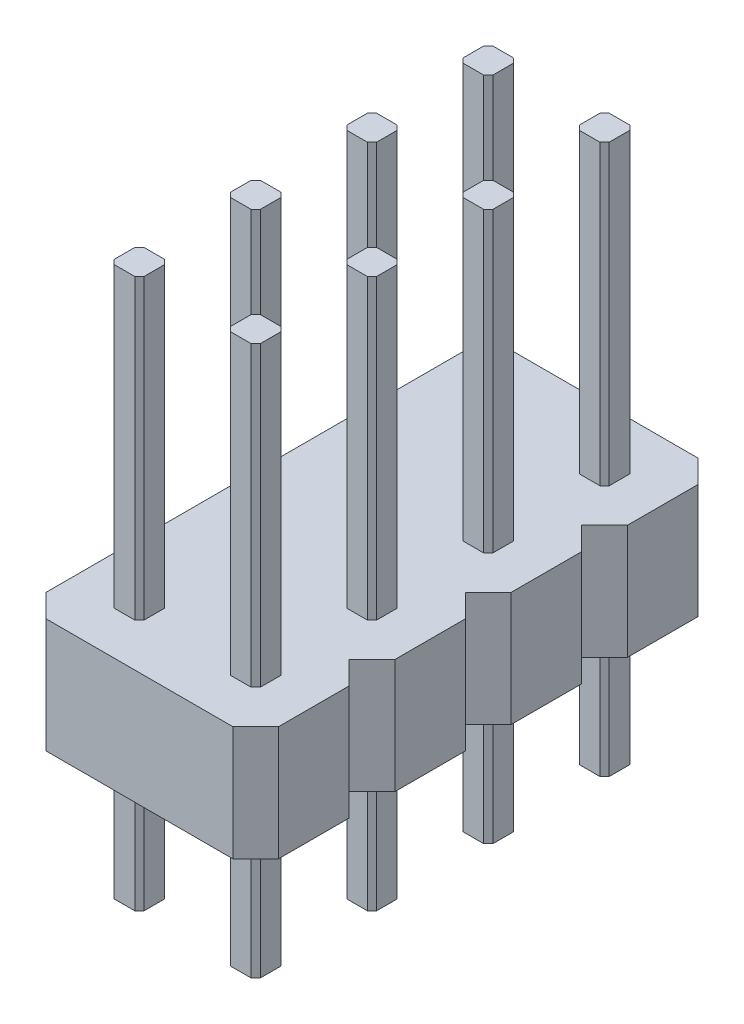
from build123d import *

# Parameters (mm, degrees)
EXTRUDE_1_DEPTH        = 12
PATTERN_LINEAR_1_COUNT = 2
PATTERN_LINEAR_1_PITCH = 2.54
EXTRUDE_2_DEPTH        = 2.5
PATTERN_LINEAR_2_COUNT = 4
PATTERN_LINEAR_2_PITCH = 2.54


with BuildPart() as part:
    # 草图1 → 凸台-拉伸1 (new body)
    with BuildSketch(Plane(origin=(0, 0, 0), x_dir=(1, 0, 0), z_dir=(0, 1, 0))):
        Polygon((-0.225, -0.325), (-0.325, -0.225), (-0.325, 0.225), (-0.225, 0.325), (0.225, 0.325), (0.325, 0.225), (0.325, -0.225), (0.225, -0.325), align=None)
    extrude(amount=EXTRUDE_1_DEPTH)


with BuildPart() as pattern_linear_1_1:
    # 阵列(线性)1: pattern copy
    add(part.part.moved(Location(Vector(1, 0, 0) * (1 * PATTERN_LINEAR_1_PITCH))))


with BuildPart() as part_1:
    add(part.part)

    add(pattern_linear_1_1.part)  # 凸台-拉伸2 merges 阵列(线性)1_1
    # 草图2 → 凸台-拉伸2 (add)
    with BuildSketch(Plane(origin=(0, 3, 0), x_dir=(-1, 0, 0), z_dir=(0, -1, 0))):
        Polygon((-3.31, 1.27), (-3.81, 0.77), (-3.81, -0.77), (-3.31, -1.27), (0.77, -1.27), (1.27, -0.77), (1.27, 0.77), (0.77, 1.27), align=None)
    extrude(amount=-EXTRUDE_2_DEPTH)


with BuildPart() as pattern_linear_2_1:
    # 阵列(线性)2: pattern copy
    add(part_1.part.moved(Location(Vector(0, 0, -1) * (1 * PATTERN_LINEAR_2_PITCH))))


with BuildPart() as pattern_linear_2_2:
    # 阵列(线性)2: pattern copy
    add(part_1.part.moved(Location(Vector(0, 0, -1) * (2 * PATTERN_LINEAR_2_PITCH))))


with BuildPart() as pattern_linear_2_3:
    # 阵列(线性)2: pattern copy
    add(part_1.part.moved(Location(Vector(0, 0, -1) * (3 * PATTERN_LINEAR_2_PITCH))))


with BuildPart() as part_2:
    add(part_1.part)

    # Combine 1: union 阵列(线性)2_1, 阵列(线性)2_2, 阵列(线性)2_3
    add(pattern_linear_2_1.part)
    add(pattern_linear_2_2.part)
    add(pattern_linear_2_3.part)


solid = part_2.part
